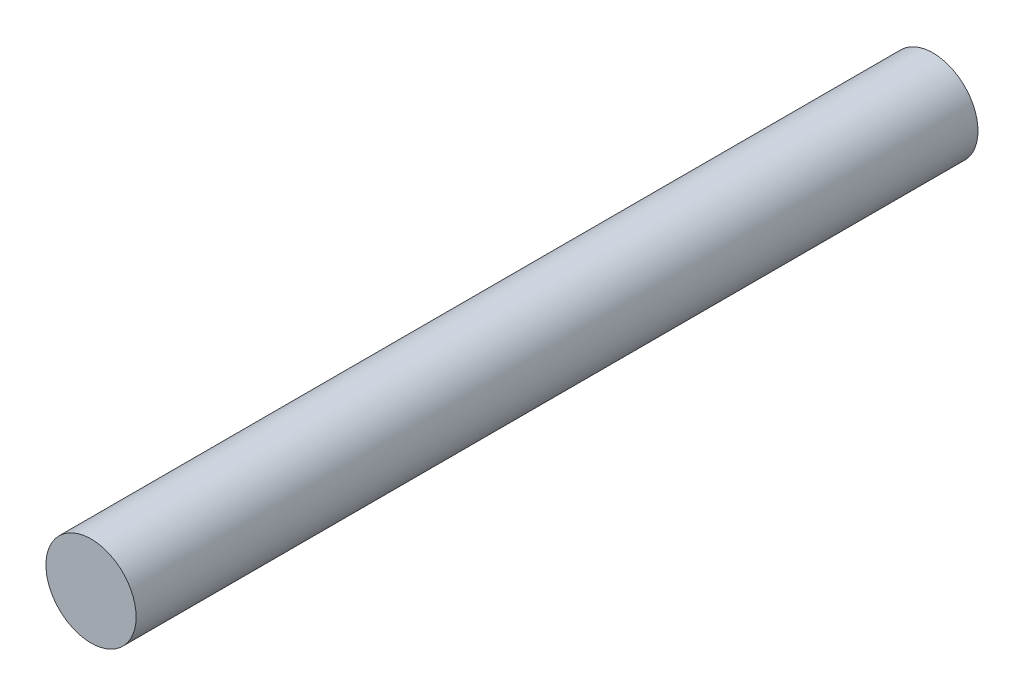
from build123d import *

# Parameters (mm, degrees)
SKETCH_1_R      = 3
EXTRUDE_1_DEPTH = 56


with BuildPart() as part:
    # 草图1 → 凸台-拉伸1 (new body)
    with BuildSketch(Plane.XY):
        Circle(SKETCH_1_R)
    extrude(amount=EXTRUDE_1_DEPTH)


solid = part.part
